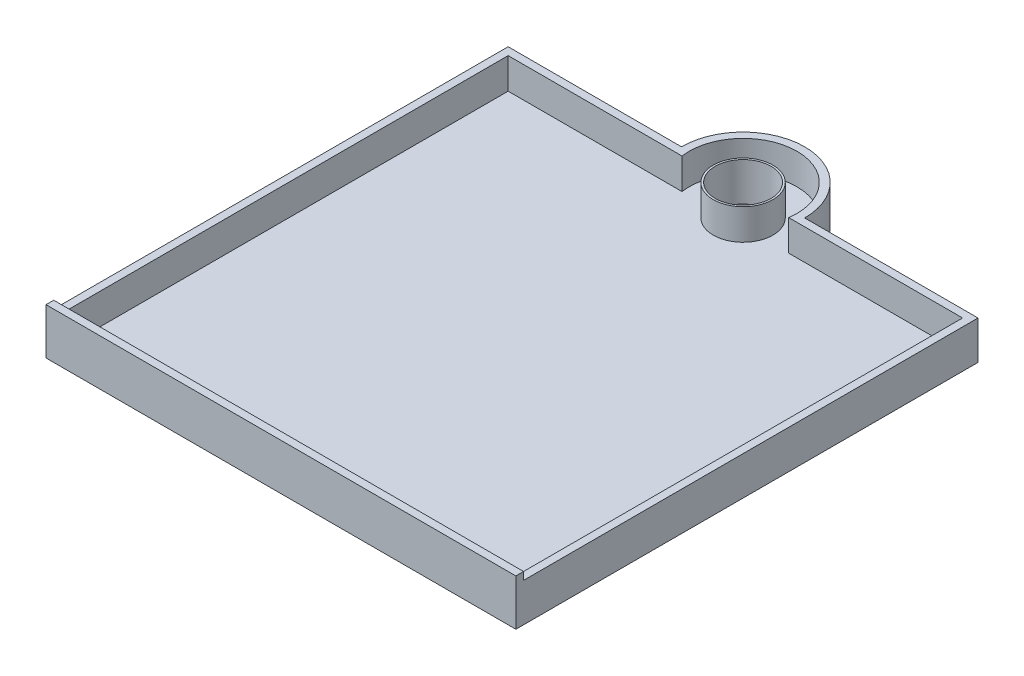
from build123d import *

# Parameters (mm, degrees)
SKETCH7_R                = 16
BOSS_EXTRUDE3_DEPTH      = 10
SKETCH8_R                = 7.25
CUT_EXTRUDE8_DEPTH       = 10
SKETCH9_R                = 14
SKETCH9_R_2              = 7.75
CUT_EXTRUDE9_DEPTH       = 8
BOSS_EXTRUDE5_DEPTH      = 8
BOSS_EXTRUDE5_DEPTH_BACK = 2
CUT_EXTRUDE11_DEPTH      = 8
BOSS_EXTRUDE6_DEPTH      = 10


with BuildPart() as part:
    # Sketch7 → Boss-Extrude3 (new body)
    with BuildSketch(Plane(origin=(0, 0, 0), x_dir=(1, 0, 0), z_dir=(0, 1, 0))):
        with Locations(Location((0, 0, 0), (0, 0, 270))):
            Circle(SKETCH7_R)
    extrude(amount=BOSS_EXTRUDE3_DEPTH)

    # Sketch8 → Cut-Extrude8 (cut)
    with BuildSketch(Plane(origin=(0, 0, 0), x_dir=(1, 0, 0), z_dir=(0, 1, 0))):
        with Locations(Location((0, 0, 0), (0, 0, 270))):
            Circle(SKETCH8_R)
    extrude(amount=CUT_EXTRUDE8_DEPTH, mode=Mode.SUBTRACT)

    # Sketch9 → Cut-Extrude9 (cut)
    with BuildSketch(Plane(origin=(0, 10, 0), x_dir=(1, 0, 0), z_dir=(0, 1, 0))):
        with Locations(Location((0, 0, 0), (0, 0, 270))):
            Circle(SKETCH9_R)
        with Locations(Location((0, 0, 0), (0, 0, 270))):
            Circle(SKETCH9_R_2, mode=Mode.SUBTRACT)
    extrude(amount=-CUT_EXTRUDE9_DEPTH, mode=Mode.SUBTRACT)

    # Sketch10 → Boss-Extrude5 (add, two sides: drawn at the far end of the back side and taken through both)
    with BuildSketch(Plane(origin=(0, 2, 0), x_dir=(1, 0, 0), z_dir=(0, 1, 0)).offset(-BOSS_EXTRUDE5_DEPTH_BACK)):
        with BuildLine():
            Line((16, 0), (61, 0))
            Line((61, 0), (61, -120))
            Line((61, -120), (-61, -120))
            Line((-61, -120), (-61, 0))
            Line((-61, 0), (-16, 0))
            ThreePointArc((-16, 0), (0, -16), (16, 0))
        make_face()
    extrude(amount=BOSS_EXTRUDE5_DEPTH + BOSS_EXTRUDE5_DEPTH_BACK)

    # Sketch11 → Cut-Extrude11 (cut)
    with BuildSketch(Plane(origin=(0, 10, 0), x_dir=(1, 0, 0), z_dir=(0, 1, 0))):
        with BuildLine():
            Line((-59, -2), (-59, -118))
            Line((-59, -118), (59, -118))
            Line((59, -118), (59, -2))
            Line((59, -2), (13.856406461, -2))
            ThreePointArc((13.856406461, -2), (0, -14), (-13.856406461, -2))
            Line((-13.856406461, -2), (-59, -2))
        make_face()
    extrude(amount=-CUT_EXTRUDE11_DEPTH, mode=Mode.SUBTRACT)

    # Sketch12 → Boss-Extrude6 (add)
    with BuildSketch(Plane(origin=(0, 2, 0), x_dir=(1, 0, 0), z_dir=(0, 1, 0))):
        Polygon((-59, -118), (-61, -118), (-61, -120), (61, -120), (61, -118), align=None)
    extrude(amount=BOSS_EXTRUDE6_DEPTH)


solid = part.part
